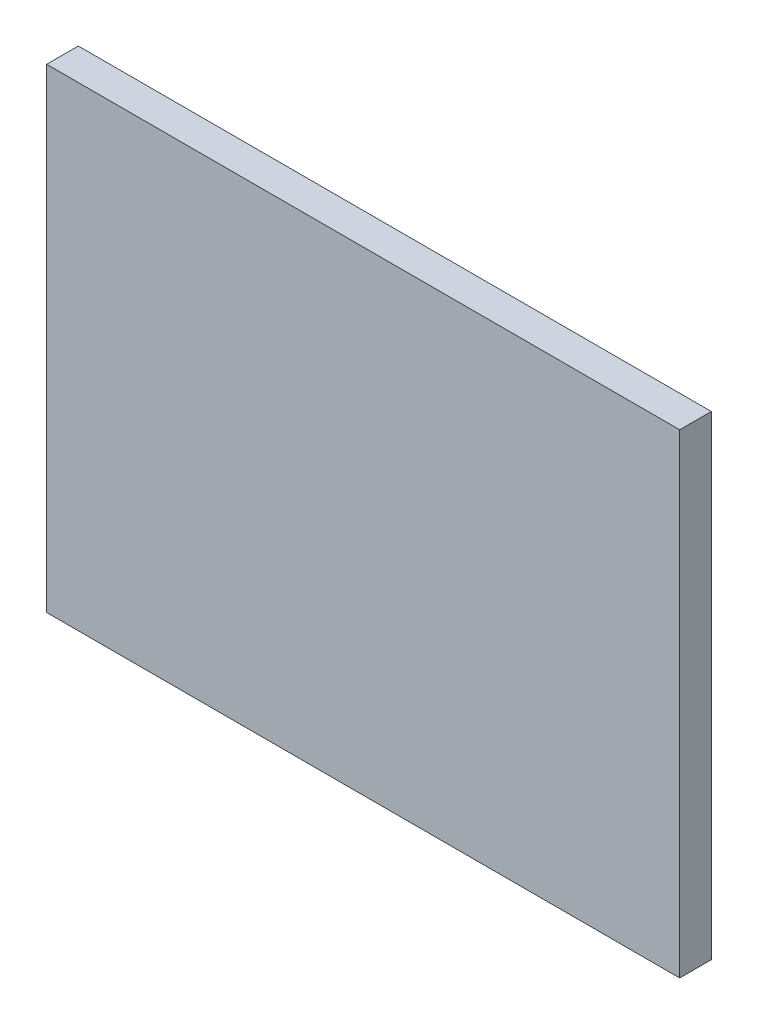
from build123d import *

# Parameters (mm, degrees)
SKETCH1_W           = 101.6
SKETCH1_H           = 76.2
BOSS_EXTRUDE1_DEPTH = 5.08


with BuildPart() as part:
    # Sketch1 → Boss-Extrude1 (new body)
    with BuildSketch(Plane.XY):
        with Locations((50.8, 38.1)):
            Rectangle(SKETCH1_W, SKETCH1_H)
    extrude(amount=BOSS_EXTRUDE1_DEPTH)


solid = part.part
